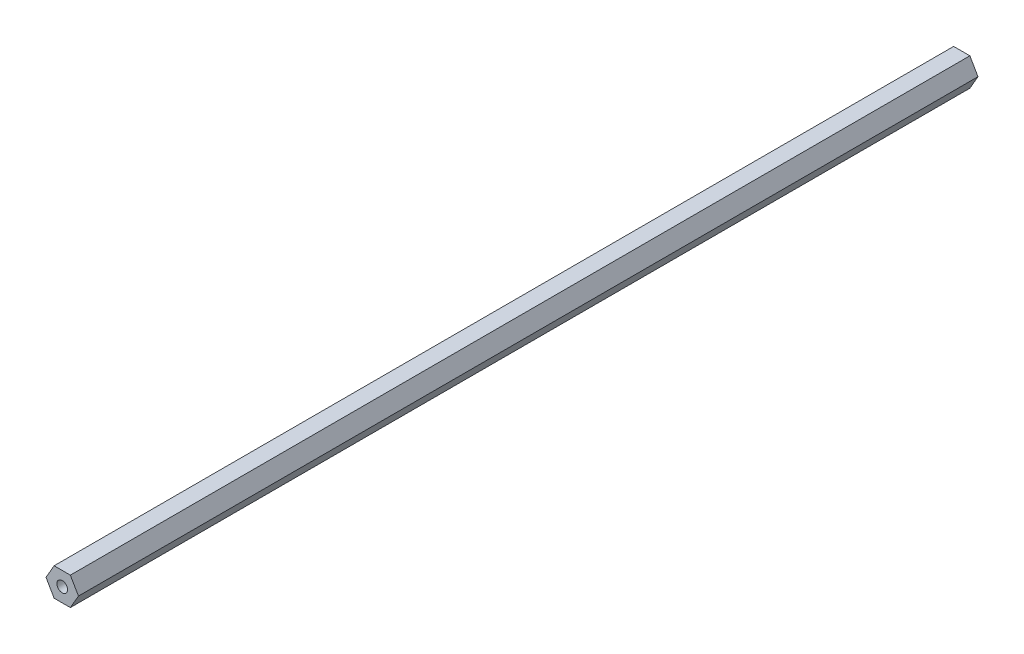
from build123d import *

# Parameters (mm, degrees)
BOSS_EXTRUDE1_DEPTH     = 406.4
CUT_EXTRUDE1_DEPTH      = 407.515738728
CUT_EXTRUDE1_DEPTH_BACK = 407.515738728
SKETCH2_R               = 2.413


with BuildPart() as part:
    # Sketch1 → Boss-Extrude1 (new body)
    with BuildSketch(Plane.XY):
        Polygon((7.332348419, 0), (3.666174209, 6.35), (-3.666174209, 6.35), (-7.332348419, 0), (-3.666174209, -6.35), (3.666174209, -6.35), align=None)
    extrude(amount=BOSS_EXTRUDE1_DEPTH)

    # Sketch2 → Cut-Extrude1 (cut, two sides: drawn at the far end of the back side and taken through both)
    with BuildSketch(Plane.XY.offset(406.4).offset(-CUT_EXTRUDE1_DEPTH_BACK)):
        Circle(SKETCH2_R)
    extrude(amount=CUT_EXTRUDE1_DEPTH + CUT_EXTRUDE1_DEPTH_BACK, mode=Mode.SUBTRACT)


solid = part.part
